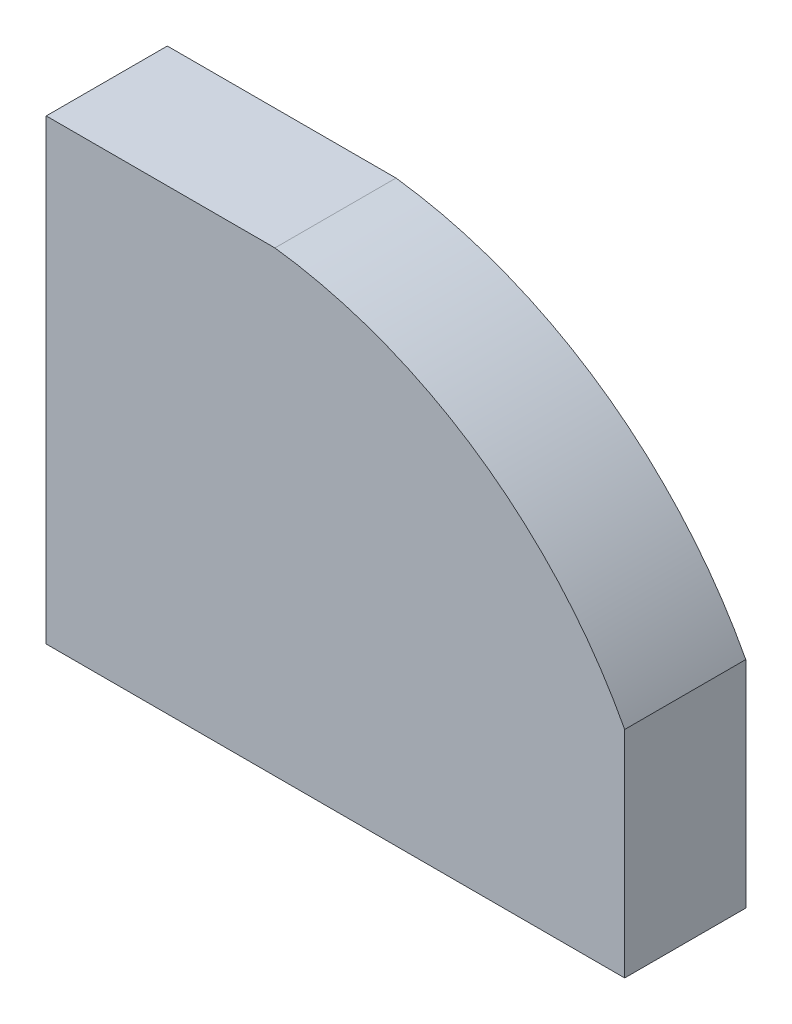
from build123d import *

# Parameters (mm, degrees)
EXTRUDE_1_DEPTH     = 9
SKETCH_2_R          = 1.75
CUT_EXTRUDE_1_DEPTH = 5


with BuildPart() as part:
    # 草图1 → 凸台-拉伸1 (new body)
    with BuildSketch(Plane.XY):
        with BuildLine():
            Line((0, 0), (43, 0))
            Line((43, 0), (43, 16))
            ThreePointArc((43, 16), (32.200157728, 28.178005607), (17, 34))
            Line((17, 34), (0, 34))
            Line((0, 34), (0, 0))
        make_face()
    extrude(amount=EXTRUDE_1_DEPTH)

    # 草图2 → 切除-拉伸1 (cut)
    with BuildSketch(Plane.XZ):
        with Locations(Location((3.75, 3.75, 0), (0, 0, 270))):
            Circle(SKETCH_2_R)
        with Locations(Location((39.25, 3.75, 0), (0, 0, 90))):
            Circle(SKETCH_2_R)
    extrude(amount=-CUT_EXTRUDE_1_DEPTH, mode=Mode.SUBTRACT)


solid = part.part
